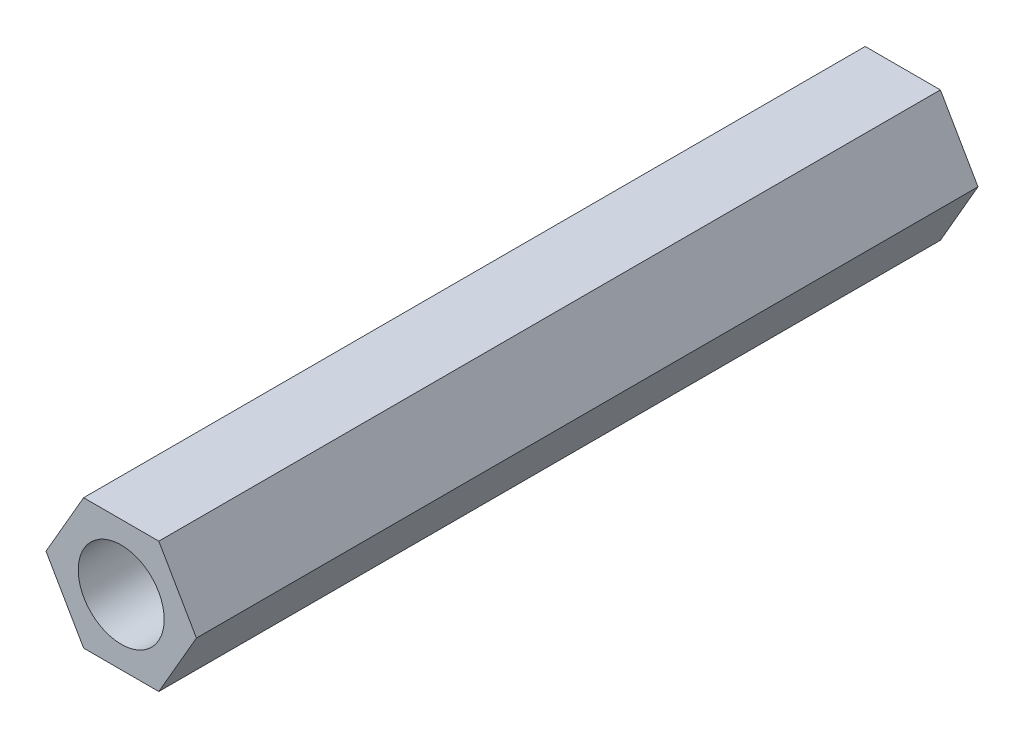
from build123d import *

# Parameters (mm, degrees)
SKETCH_1_R        = 1.65
F_30MM_M3_5_DEPTH = 30


with BuildPart() as part:
    # 草图1 → 30mm铝柱_M3通孔_六角5 (new body)
    with BuildSketch(Plane.XY):
        Polygon((2.886751346, 0), (1.443375673, 2.5), (-1.443375673, 2.5), (-2.886751346, 0), (-1.443375673, -2.5), (1.443375673, -2.5), align=None)
        Circle(SKETCH_1_R, mode=Mode.SUBTRACT)
    extrude(amount=F_30MM_M3_5_DEPTH)


solid = part.part
